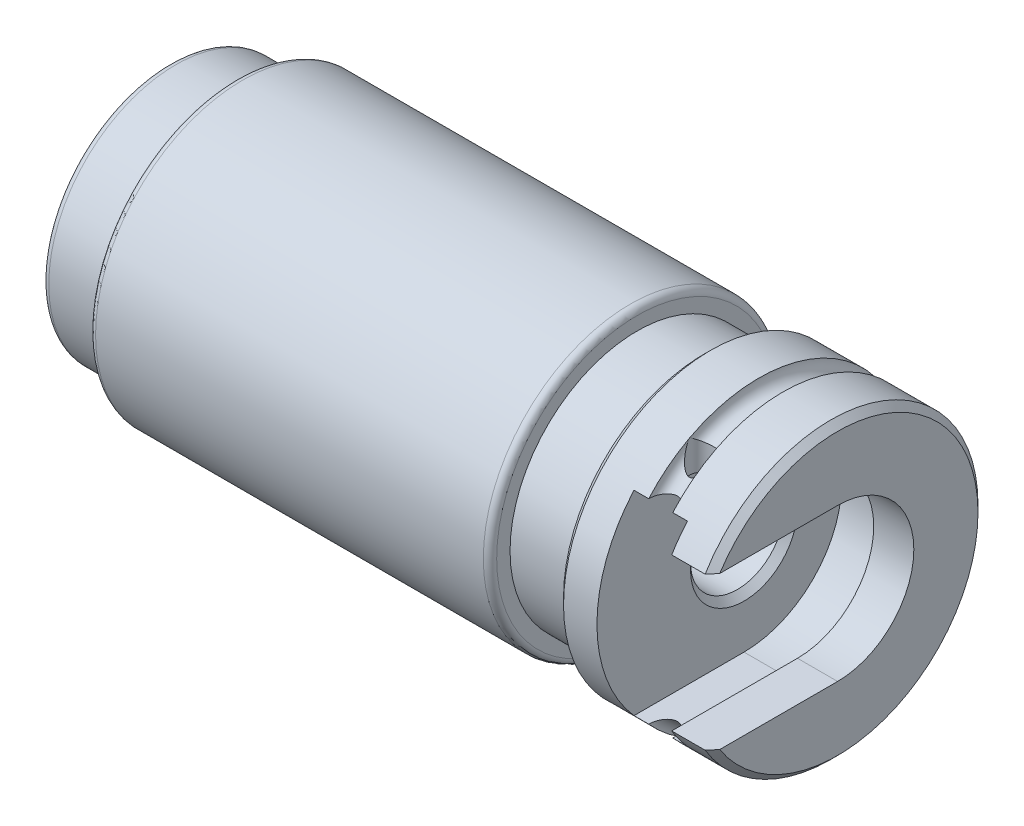
from build123d import *

# Parameters (mm, degrees)
ESBO_O2_W             = 11.092241592
ESBO_O2_H             = 11.4
CORTE_EXTRUS_O1_DEPTH = 3
ESBO_O6_W             = 12.102266842
ESBO_O6_H             = 14.6
CORTE_EXTRUS_O2_DEPTH = 4
CHANFRO1_SIZE         = 1
FILETE1_R             = 0.5
CHANFRO2_SIZE         = 0.5
CHANFRO3_SIZE         = 0.5
CORTE_EXTRUS_O3_REACH = 56.368
ESBO_O7_R             = 0.9
FILETE2_R             = 0.5
FILETE3_R             = 0.5


with BuildPart() as part:
    # Esboço1 → Revolução1 (revolve)
    with BuildSketch(Plane(origin=(0, 0, 0), x_dir=(1, 0, 0), z_dir=(0, 1, 0)), mode=Mode.PRIVATE) as revolu_o1_sk:
        with BuildLine():
            Line((0, 3.5), (43, 3.5))
            Line((43, 3.5), (43, 7.3))
            Line((43, 7.3), (47, 7.3))
            Line((47, 7.3), (47, 5.7))
            Line((47, 5.7), (50, 5.7))
            Line((50, 5.7), (50, 11))
            Line((50, 11), (45.9, 11))
            ThreePointArc((45.9, 11), (45, 10.1), (44.1, 11))
            Line((44.1, 11), (40, 11))
            Line((40, 11), (40, 9.5))
            Line((40, 9.5), (35, 9.5))
            Line((35, 9.5), (35, 11))
            Line((35, 11), (5, 11))
            Line((5, 11), (5, 9.5))
            Line((5, 9.5), (0, 9.5))
            Line((0, 9.5), (0, 3.5))
        make_face()
    revolve(revolu_o1_sk.sketch.rotate(Axis((0, 0, 0), (1, 0, 0)), 180), axis=Axis((0, 0, 0), (1, 0, 0)))

    # Esboço2 → Corte-extrusão1 (cut)
    with BuildSketch(Plane(origin=(50, 0, 0), x_dir=(0, 0, -1), z_dir=(1, 0, 0))):
        with Locations((-5.546120796, 0)):
            Rectangle(ESBO_O2_W, ESBO_O2_H)
    extrude(amount=-CORTE_EXTRUS_O1_DEPTH, mode=Mode.SUBTRACT)

    # Esboço6 → Corte-extrusão2 (cut)
    with BuildSketch(Plane(origin=(43, 0, 0), x_dir=(0, 0, -1), z_dir=(1, 0, 0))):
        with Locations((-6.051133421, 0)):
            Rectangle(ESBO_O6_W, ESBO_O6_H)
    extrude(amount=CORTE_EXTRUS_O2_DEPTH, mode=Mode.SUBTRACT)

    # Chanfro1
    chanfro1_edges = [part.edges().sort_by_distance(p)[0] for p in [
        (0, 0, -3.5),
    ]]
    chamfer(chanfro1_edges, length=CHANFRO1_SIZE)

    # Filete1
    filete1_edges = [part.edges().sort_by_distance(p)[0] for p in [
        (0, 0, -9.5),
    ]]
    fillet(filete1_edges, radius=FILETE1_R)

    # Chanfro2
    chanfro2_edges = [part.edges().sort_by_distance(p)[0] for p in [
        (40, 0, -11),
        (50, 0, -11),
    ]]
    chamfer(chanfro2_edges, length=CHANFRO2_SIZE)

    # Chanfro3
    chanfro3_edges = [part.edges().sort_by_distance(p)[0] for p in [
        (43, 0, -3.5),
    ]]
    chamfer(chanfro3_edges, length=CHANFRO3_SIZE)

    # Esboço7 → Corte-extrusão3 (cut, up to next)
    with BuildSketch(Plane.XZ.offset(-7.3), mode=Mode.PRIVATE) as corte_extrus_o3_sk1:
        with Locations(Location((44.997134116, 5.179978196, 0), (0, 0, 270))):
            Circle(ESBO_O7_R)
    corte_extrus_o3_tool1 = extrude(corte_extrus_o3_sk1.sketch, amount=-CORTE_EXTRUS_O3_REACH, mode=Mode.PRIVATE) & part.part
    add(corte_extrus_o3_tool1.solids().sort_by_distance((44.997134, 7.3, 5.179978))[0], mode=Mode.SUBTRACT)

    # Filete2
    filete2_edges = [part.edges().sort_by_distance(p)[0] for p in [
        (5, 0, -11),
    ]]
    fillet(filete2_edges, radius=FILETE2_R)

    # Filete3
    filete3_edges = [part.edges().sort_by_distance(p)[0] for p in [
        (35, 0, -11),
    ]]
    fillet(filete3_edges, radius=FILETE3_R)


solid = part.part
